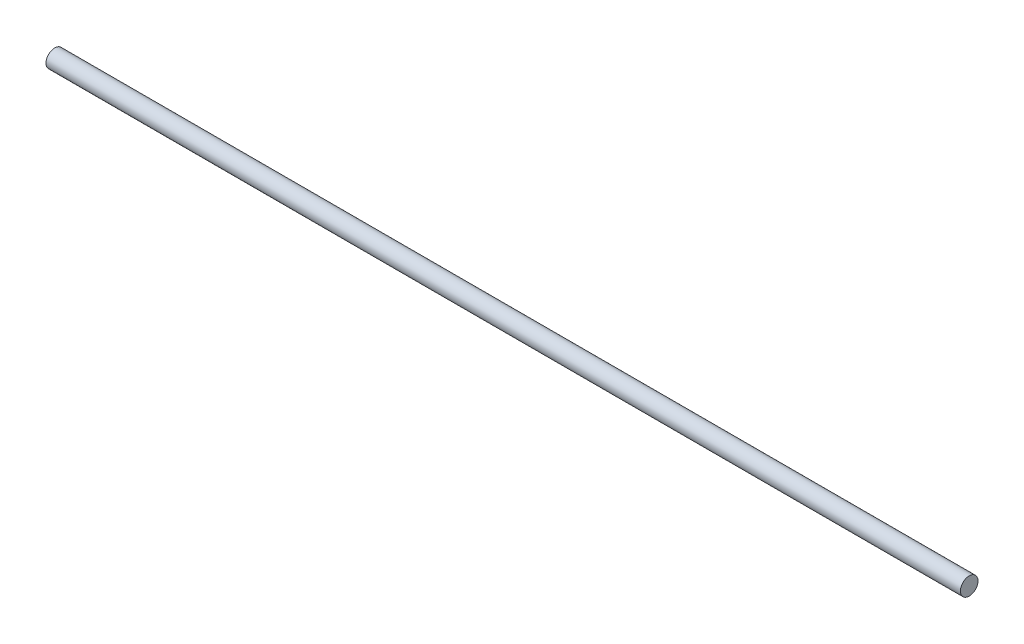
from build123d import *

# Parameters (mm, degrees)
SKETCH1_R           = 5
BOSS_EXTRUDE1_DEPTH = 520


with BuildPart() as part:
    # Sketch1 → Boss-Extrude1 (new body)
    with BuildSketch(Plane(origin=(0, 0, 0), x_dir=(0, 0, -1), z_dir=(1, 0, 0))):
        Circle(SKETCH1_R)
    extrude(amount=-BOSS_EXTRUDE1_DEPTH)


solid = part.part
